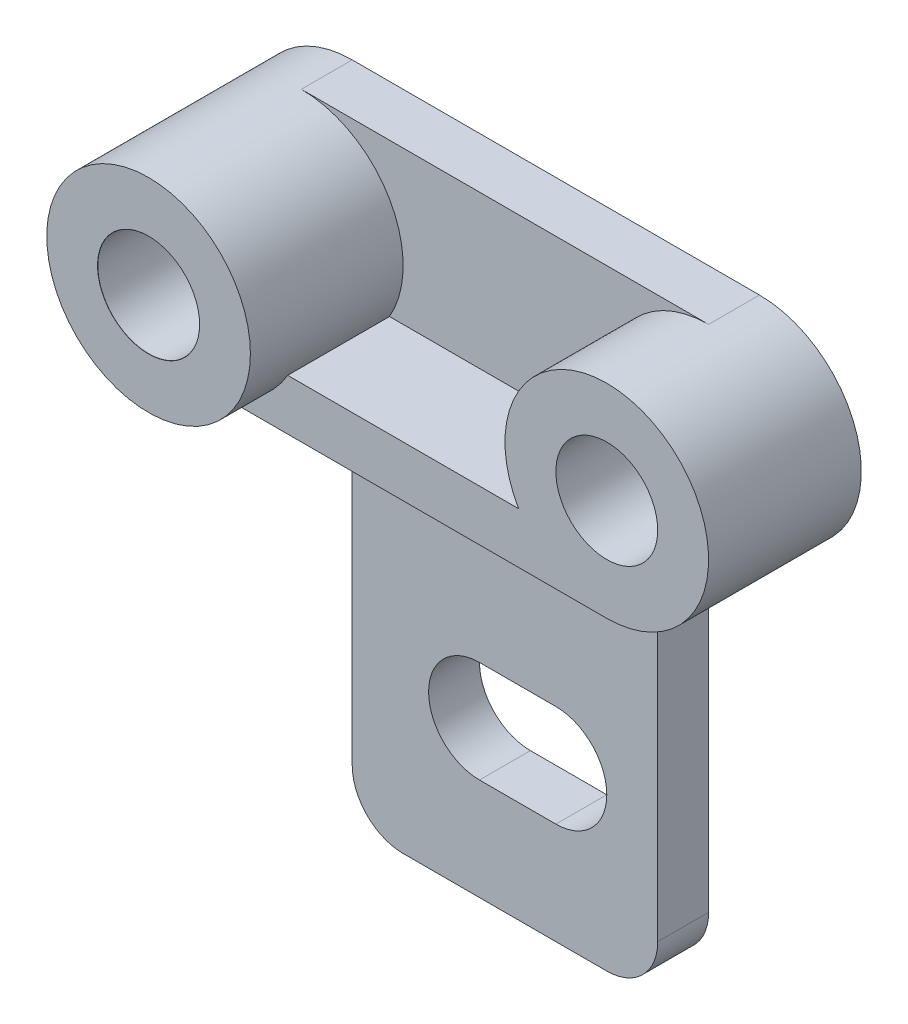
from build123d import *

# Parameters (mm, degrees)
SKETCH1_R                        = 20
BOSS_EXTRUDE1_DEPTH              = 40
SKETCH1_3_R                      = 20
BOSS_EXTRUDE2_DEPTH              = 30
SKETCH2_W                        = 80
SKETCH2_H                        = 40
BOSS_EXTRUDE3_DEPTH              = 10
SKETCH3_W                        = 80
SKETCH3_H                        = 10
BOSS_EXTRUDE4_DEPTH              = 30
BOSS_EXTRUDE5_DEPTH              = 10
CUT_EXTRUDE1_DEPTH               = 121.415945788
F_20_0MM_DOWEL_HOLE1_D           = 20
F_20_0MM_DOWEL_HOLE1_CSINK_D     = 20.05
F_20_0MM_DOWEL_HOLE1_CSINK_ANGLE = 100


with BuildPart() as part:
    # Sketch1 → Boss-Extrude1 (new body)
    with BuildSketch(Plane.XY):
        with Locations((-40, 0)):
            Circle(SKETCH1_R)
    extrude(amount=BOSS_EXTRUDE1_DEPTH)



with BuildPart() as body_2:
    # Sketch1<3> → Boss-Extrude2 (new body)
    with BuildSketch(Plane.XY):
        with Locations((40, 0)):
            Circle(SKETCH1_3_R)
    extrude(amount=BOSS_EXTRUDE2_DEPTH)


with BuildPart() as part_1:
    add(part.part)

    add(body_2.part)  # Boss-Extrude3 merges body 2
    # Sketch2 → Boss-Extrude3 (add)
    with BuildSketch(Plane(origin=(0, 0, 0), x_dir=(-1, 0, 0), z_dir=(0, 0, -1))):
        Rectangle(SKETCH2_W, SKETCH2_H)
    extrude(amount=-BOSS_EXTRUDE3_DEPTH)

    # Sketch3 → Boss-Extrude4 (add)
    with BuildSketch(Plane.XY.offset(30)):
        with Locations((0, -15)):
            Rectangle(SKETCH3_W, SKETCH3_H)
    extrude(amount=-BOSS_EXTRUDE4_DEPTH)

    # Sketch4 → Boss-Extrude5 (add)
    with BuildSketch(Plane(origin=(0, 0, 0), x_dir=(-1, 0, 0), z_dir=(0, 0, -1))):
        with BuildLine():
            Line((-30, -20), (30, -20))
            Line((30, -20), (30, -90))
            ThreePointArc((30, -90), (27.071067812, -97.071067812), (20, -100))
            Line((20, -100), (-20, -100))
            ThreePointArc((-20, -100), (-27.071067812, -97.071067812), (-30, -90))
            Line((-30, -90), (-30, -20))
        make_face()
    extrude(amount=-BOSS_EXTRUDE5_DEPTH)

    # Sketch5 → Cut-Extrude1 (cut, through all)
    with BuildSketch(Plane.XY.offset(10)):
        with BuildLine():
            Line((-5, -60), (10, -60))
            ThreePointArc((10, -60), (20, -70), (10, -80))
            Line((10, -80), (-5, -80))
            ThreePointArc((-5, -80), (-15, -70), (-5, -60))
        make_face()
    extrude(amount=-CUT_EXTRUDE1_DEPTH, mode=Mode.SUBTRACT)

    # Ø20.0mm Dowel Hole1 (through all)
    with Locations(Plane.XY.offset(40)):
        with Locations((-40, 0), (40, 0)):
            CounterSinkHole(F_20_0MM_DOWEL_HOLE1_D / 2, F_20_0MM_DOWEL_HOLE1_CSINK_D / 2, counter_sink_angle=F_20_0MM_DOWEL_HOLE1_CSINK_ANGLE)


solid = part_1.part
